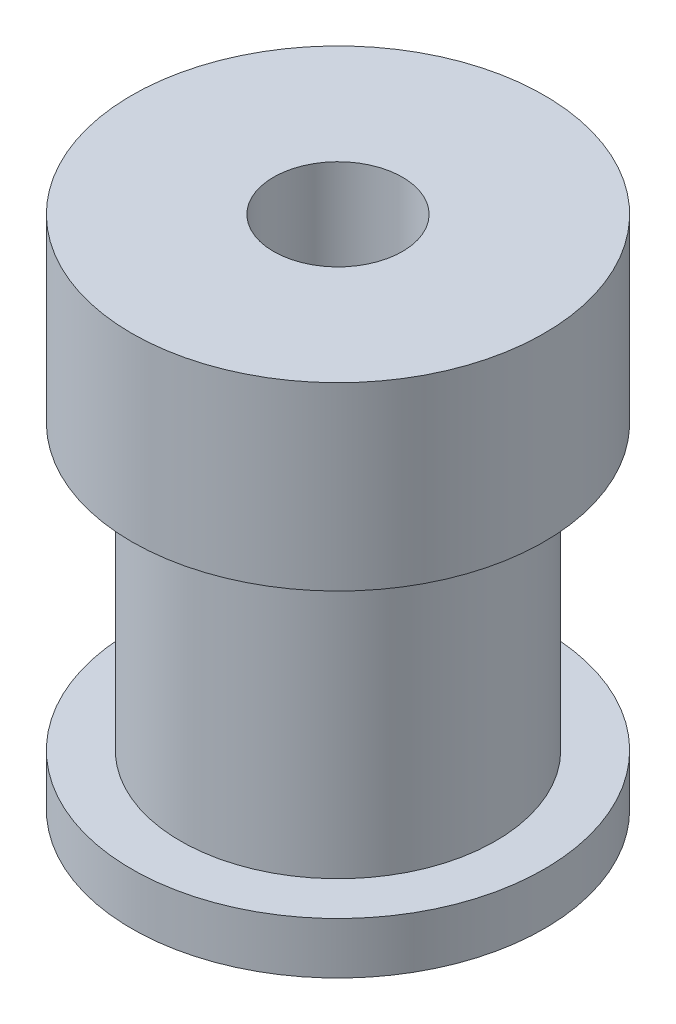
from build123d import *

# Parameters (mm, degrees)
SKETCH_1_R          = 8
EXTRUDE_1_DEPTH     = 7
SKETCH_2_R          = 6.11
EXTRUDE_2_DEPTH     = 11
EXTRUDE_START       = 2
SKETCH_3_R          = 8
EXTRUDE_3_DEPTH     = 2
SKETCH_4_R          = 2.5
CUT_EXTRUDE_1_DEPTH = 25


with BuildPart() as part:
    # 草图1 → 凸台-拉伸1 (new body)
    with BuildSketch(Plane(origin=(0, 0, 0), x_dir=(1, 0, 0), z_dir=(0, 1, 0))):
        with Locations(Location((0, 0, 0), (0, 0, 270))):
            Circle(SKETCH_1_R)
    extrude(amount=EXTRUDE_1_DEPTH)

    # 草图2 → 凸台-拉伸2 (add)
    with BuildSketch(Plane.XZ):
        with Locations(Location((0, 0, 0), (0, 0, 270))):
            Circle(SKETCH_2_R)
    extrude(amount=EXTRUDE_2_DEPTH)

    # 草图3 → 凸台-拉伸3 (add)
    with BuildSketch(Plane.XZ.offset(11).offset(EXTRUDE_START)):
        with Locations(Location((0, 0, 0), (0, 0, 90))):
            Circle(SKETCH_3_R)
    extrude(amount=-EXTRUDE_3_DEPTH)

    # 草图4 → 切除-拉伸1 (cut)
    with BuildSketch(Plane(origin=(0, 7, 0), x_dir=(1, 0, 0), z_dir=(0, 1, 0))):
        with Locations(Location((0, 0, 0), (0, 0, 270))):
            Circle(SKETCH_4_R)
    extrude(amount=-CUT_EXTRUDE_1_DEPTH, mode=Mode.SUBTRACT)


solid = part.part
